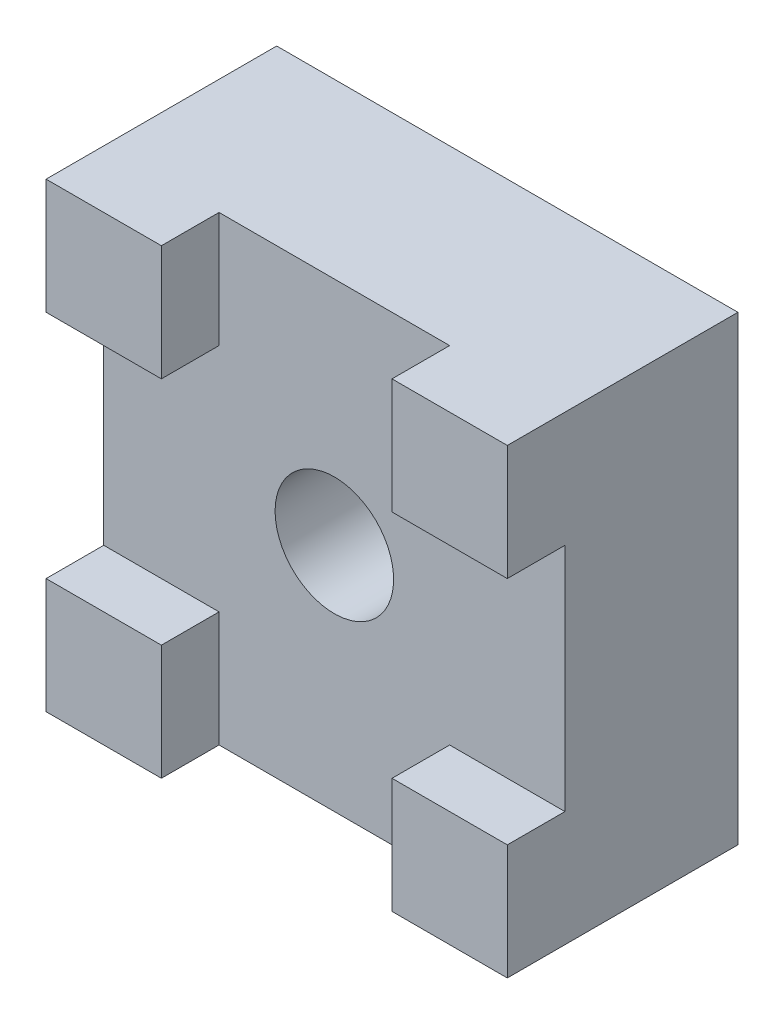
from build123d import *

# Parameters (mm, degrees)
SKETCH1_W           = 25.4
SKETCH1_H           = 25.4
BOSS_EXTRUDE1_DEPTH = 9.525
SKETCH2_R           = 6.35
CUT_EXTRUDE1_DEPTH  = 4.7752
SKETCH1_3_R         = 3.2639
CUT_EXTRUDE2_DEPTH  = 9.525
SKETCH3_W           = 6.35
SKETCH3_H           = 6.35
BOSS_EXTRUDE3_DEPTH = 3.175


with BuildPart() as part:
    # Sketch1 → Boss-Extrude1 (new body)
    with BuildSketch(Plane(origin=(0, 0, 0), x_dir=(0, 1, 0), z_dir=(0, 0, 1))):
        Rectangle(SKETCH1_W, SKETCH1_H)
    extrude(amount=BOSS_EXTRUDE1_DEPTH)

    # Sketch2 → Cut-Extrude1 (cut)
    with BuildSketch(Plane(origin=(0, 0, 0), x_dir=(1, 0, 0), z_dir=(0, 0, -1))):
        Circle(SKETCH2_R)
    extrude(amount=-CUT_EXTRUDE1_DEPTH, mode=Mode.SUBTRACT)

    # Sketch1<3> → Cut-Extrude2 (cut)
    with BuildSketch(Plane(origin=(0, 0, 0), x_dir=(0, 1, 0), z_dir=(0, 0, 1))):
        Circle(SKETCH1_3_R)
    extrude(amount=CUT_EXTRUDE2_DEPTH, mode=Mode.SUBTRACT)

    # Sketch3 → Boss-Extrude3 (add)
    with BuildSketch(Plane.XY.offset(9.525)):
        with Locations((-9.525, 9.525)):
            Rectangle(SKETCH3_W, SKETCH3_H)
        with Locations((-9.525, -9.525)):
            Rectangle(SKETCH3_W, SKETCH3_H)
        with Locations((9.525, -9.525)):
            Rectangle(SKETCH3_W, SKETCH3_H)
        with Locations((9.525, 9.525)):
            Rectangle(SKETCH3_W, SKETCH3_H)
    extrude(amount=BOSS_EXTRUDE3_DEPTH)


solid = part.part
